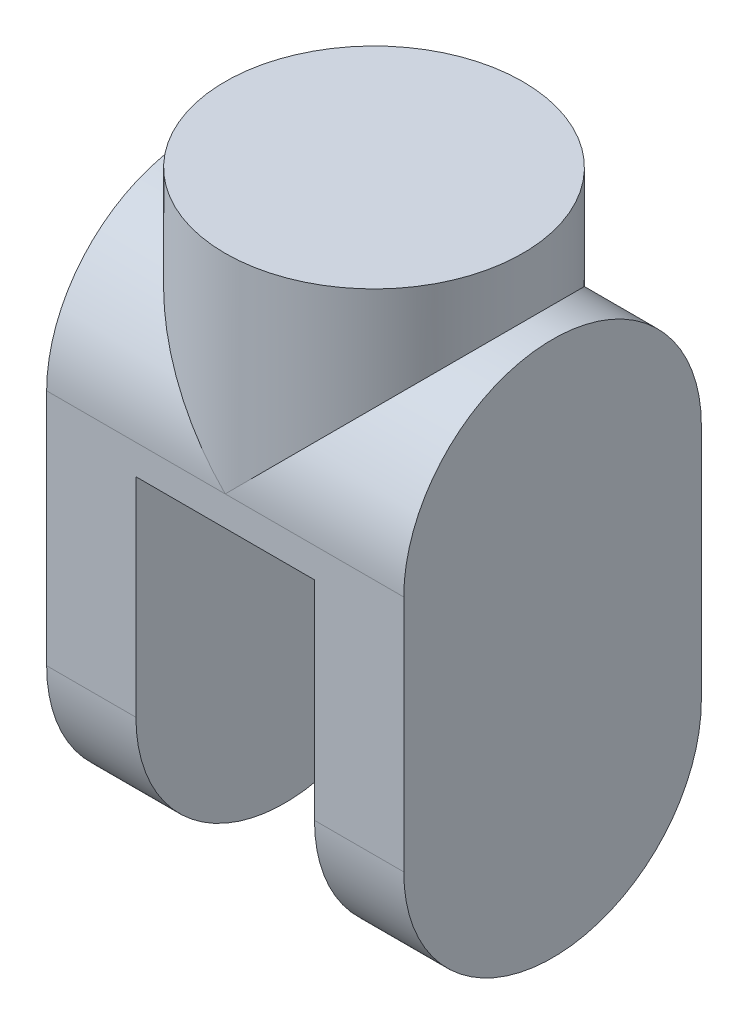
from build123d import *

# Parameters (mm, degrees)
SALIENTE_EXTRUIR1_DEPTH      = 60
CORTAR_EXTRUIR1_DEPTH        = 30
SALIENTE_EXTRUIR2_REACH      = 216.709
SALIENTE_EXTRUIR2_END_RADIUS = 50
CROQUIS3_R                   = 50


with BuildPart() as part:
    # Croquis1 → Saliente-Extruir1 (new, symmetric)
    with BuildSketch(Plane(origin=(0, 0, 0), x_dir=(0, 0, -1), z_dir=(1, 0, 0))):
        with BuildLine():
            Line((-50, 80), (-50, 0))
            ThreePointArc((-50, 0), (0, -50), (50, 0))
            Line((50, 0), (50, 80))
            ThreePointArc((50, 80), (0, 130), (-50, 80))
        make_face()
    extrude(amount=SALIENTE_EXTRUIR1_DEPTH, both=True)

    # Croquis2 → Cortar-Extruir1 (cut, symmetric)
    with BuildSketch(Plane(origin=(0, 0, 0), x_dir=(0, 0, -1), z_dir=(1, 0, 0))):
        with BuildLine():
            Line((-50, 70), (50, 70))
            Line((50, 70), (50, 0))
            ThreePointArc((50, 0), (0, -50), (-50, 0))
            Line((-50, 0), (-50, 70))
        make_face()
    extrude(amount=CORTAR_EXTRUIR1_DEPTH, both=True, mode=Mode.SUBTRACT)

    # Saliente-Extruir2: up to this cylinder (the profile starts outside it)
    saliente_extruir2_end = Plane(origin=(0, 80, 0), z_dir=(-1, 0, 0)) * Cylinder(SALIENTE_EXTRUIR2_END_RADIUS, 534.418, mode=Mode.PRIVATE)
    # Croquis3 → Saliente-Extruir2 (add, up to the surface)
    with BuildSketch(Plane(origin=(0, 150, 0), x_dir=(1, 0, 0), z_dir=(0, 1, 0)), mode=Mode.PRIVATE) as saliente_extruir2_sk1:
        with Locations(Location((0, 0, 0), (0, 0, 270))):
            Circle(CROQUIS3_R)
    saliente_extruir2_tool1 = extrude(saliente_extruir2_sk1.sketch, amount=-SALIENTE_EXTRUIR2_REACH, mode=Mode.PRIVATE) - saliente_extruir2_end
    add(saliente_extruir2_tool1.solids().sort_by_distance((0, 150, 0))[0])


solid = part.part
